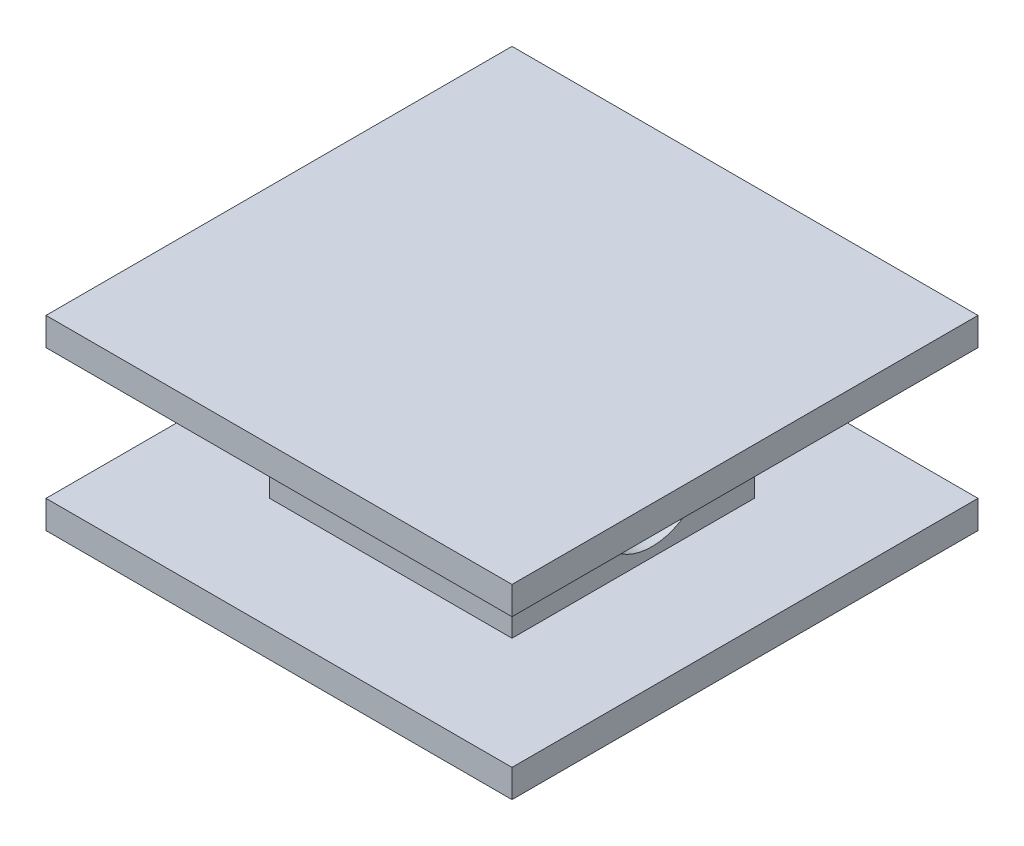
from build123d import *

# Parameters (mm, degrees)
EXTRUDE_1_DEPTH      = 5
EXTRUDE_1_DEPTH_BACK = 5
SKETCH_1_W           = 25
SKETCH_1_H           = 25
SKETCH_8_W           = 25
SKETCH_8_H           = 7
CUT_EXTRUDE_8_DEPTH  = 6
SKETCH_9_W           = 25
SKETCH_9_H           = 7
CUT_EXTRUDE_9_DEPTH  = 6
SKETCH_2_R           = 3.5
CUT_EXTRUDE_1_DEPTH  = 10
SKETCH_4_R           = 1.25
CUT_EXTRUDE_3_DEPTH  = 6
SKETCH_7_R           = 3
CUT_EXTRUDE_7_DEPTH  = 21.910523666


with BuildPart() as part:
    # 草图1 → 拉伸1 (new, two sides: drawn at the far end of the back side and taken through both)
    with BuildSketch(Plane(origin=(0, 0, 0), x_dir=(1, 0, 0), z_dir=(0, 1, 0)).offset(-EXTRUDE_1_DEPTH_BACK)):
        Rectangle(SKETCH_1_W, SKETCH_1_H)
    extrude(amount=EXTRUDE_1_DEPTH + EXTRUDE_1_DEPTH_BACK)

    # 草图8 → 切除-拉伸8 (cut)
    with BuildSketch(Plane(origin=(-12.5, 0, 0), x_dir=(0, 0, -1), z_dir=(1, 0, 0))):
        Rectangle(SKETCH_8_W, SKETCH_8_H)
    cut_extrude_8 = extrude(amount=CUT_EXTRUDE_8_DEPTH, mode=Mode.SUBTRACT)

    # 镜向1: 切除-拉伸8 across plane
    add(cut_extrude_8.mirror(Plane(origin=(0, 0, 0), x_dir=(0, 0, 1), z_dir=(1, 0, 0))), mode=Mode.SUBTRACT)

    # 草图9 → 切除-拉伸9 (cut)
    with BuildSketch(Plane.XY.offset(12.5)):
        Rectangle(SKETCH_9_W, SKETCH_9_H)
    cut_extrude_9 = extrude(amount=-CUT_EXTRUDE_9_DEPTH, mode=Mode.SUBTRACT)

    # 镜向2: 切除-拉伸9 across plane
    add(cut_extrude_9.mirror(Plane.XY), mode=Mode.SUBTRACT)

    # 草图2 → 切除-拉伸1 (cut)
    with BuildSketch(Plane(origin=(-6.5, 0, 0), x_dir=(0, 0, -1), z_dir=(1, 0, 0))):
        with Locations((1, 0)):
            Circle(SKETCH_2_R)
    extrude(amount=CUT_EXTRUDE_1_DEPTH, mode=Mode.SUBTRACT)

    # 草图4 → 切除-拉伸3 (cut)
    with BuildSketch(Plane(origin=(-6.5, 0, 0), x_dir=(0, 0, -1), z_dir=(1, 0, 0))):
        with Locations((-3.3, 0)):
            Circle(SKETCH_4_R)
    extrude(amount=CUT_EXTRUDE_3_DEPTH, mode=Mode.SUBTRACT)

    # 草图7 → 切除-拉伸7 (cut, through all)
    with BuildSketch(Plane.ZY.offset(-3.5)):
        with Locations((-1, 0)):
            Circle(SKETCH_7_R)
    extrude(amount=-CUT_EXTRUDE_7_DEPTH, mode=Mode.SUBTRACT)


solid = part.part
